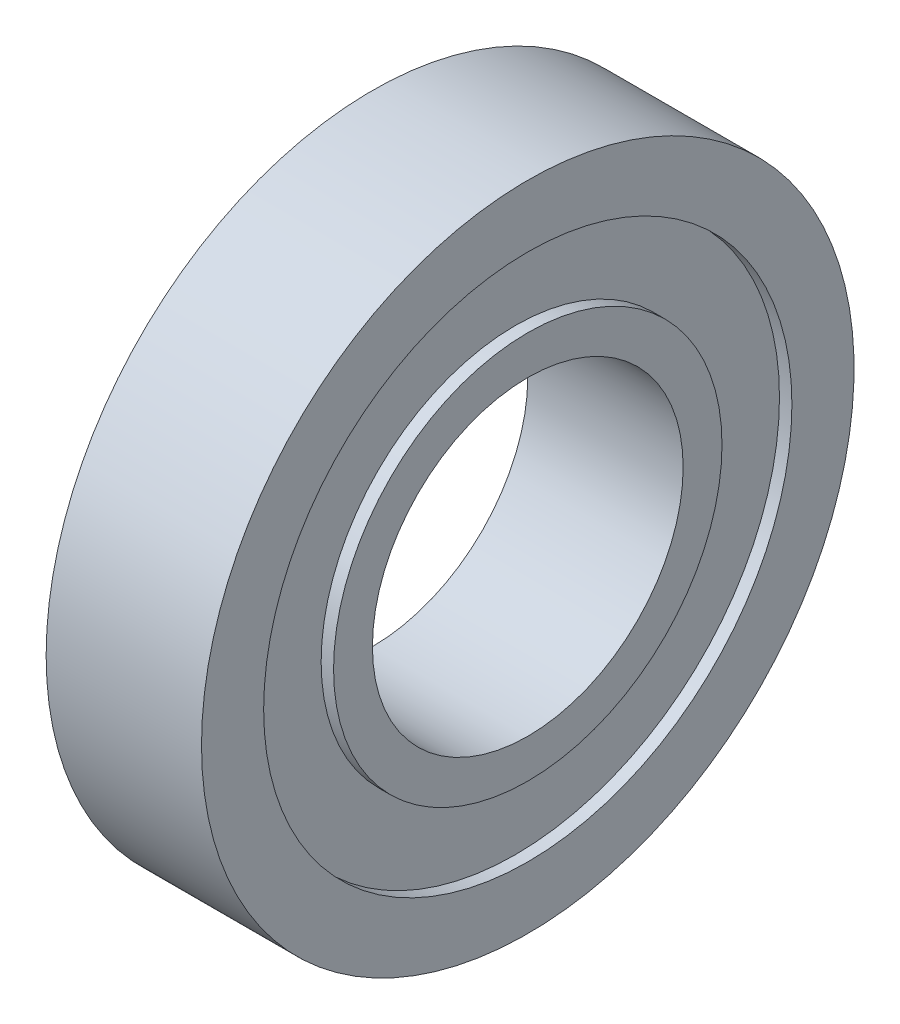
from build123d import *


with BuildPart() as part:
    # Sketch1 → Revolve1 (revolve)
    with BuildSketch(Plane(origin=(0, 0, 0), x_dir=(1, 0, 0), z_dir=(0, 1, 0)), mode=Mode.PRIVATE) as revolve1_sk:
        Polygon((0, 5), (0, 6.25), (0.4, 6.25), (0.4, 8.5), (0, 8.5), (0, 10.5), (5, 10.5), (5, 8.5), (4.6, 8.5), (4.6, 6.25), (5, 6.25), (5, 5), align=None)
    revolve(revolve1_sk.sketch.rotate(Axis((0, 0, 0), (1, 0, 0)), 180), axis=Axis((0, 0, 0), (1, 0, 0)))


solid = part.part
